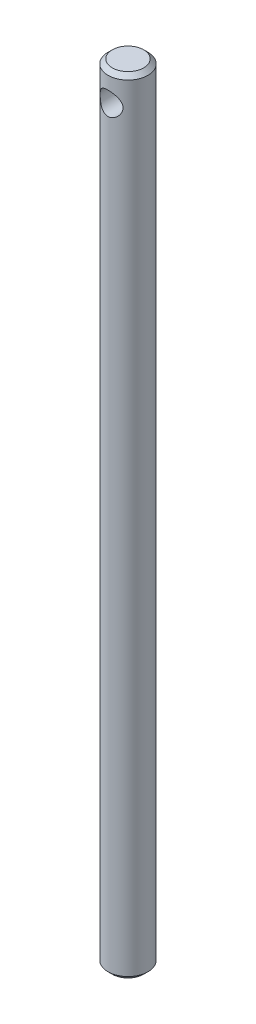
from build123d import *

# Parameters (mm, degrees)
SKETCH1_R               = 14
BOSS_EXTRUDE1_DEPTH     = 550
CUT_EXTRUDE1_DEPTH      = 551.356248261
CUT_EXTRUDE1_DEPTH_BACK = 551.356248261
SKETCH2_R               = 8
CHAMFER1_SIZE           = 3


with BuildPart() as part:
    # Sketch1 → Boss-Extrude1 (new body)
    with BuildSketch(Plane(origin=(0, 0, 0), x_dir=(1, 0, 0), z_dir=(0, 1, 0))):
        with Locations(Location((0, 0, 0), (0, 0, 270))):
            Circle(SKETCH1_R)
    extrude(amount=BOSS_EXTRUDE1_DEPTH)

    # Sketch2 → Cut-Extrude1 (cut, two sides: drawn at the far end of the back side and taken through both)
    with BuildSketch(Plane.XY.offset(-CUT_EXTRUDE1_DEPTH_BACK)):
        with Locations((0, 530)):
            Circle(SKETCH2_R)
    extrude(amount=CUT_EXTRUDE1_DEPTH + CUT_EXTRUDE1_DEPTH_BACK, mode=Mode.SUBTRACT)

    # Chamfer1
    chamfer1_edges = [part.edges().sort_by_distance(p)[0] for p in [
        (0, 0, -14),
        (0, 550, -14),
    ]]
    chamfer(chamfer1_edges, length=CHAMFER1_SIZE)


solid = part.part
